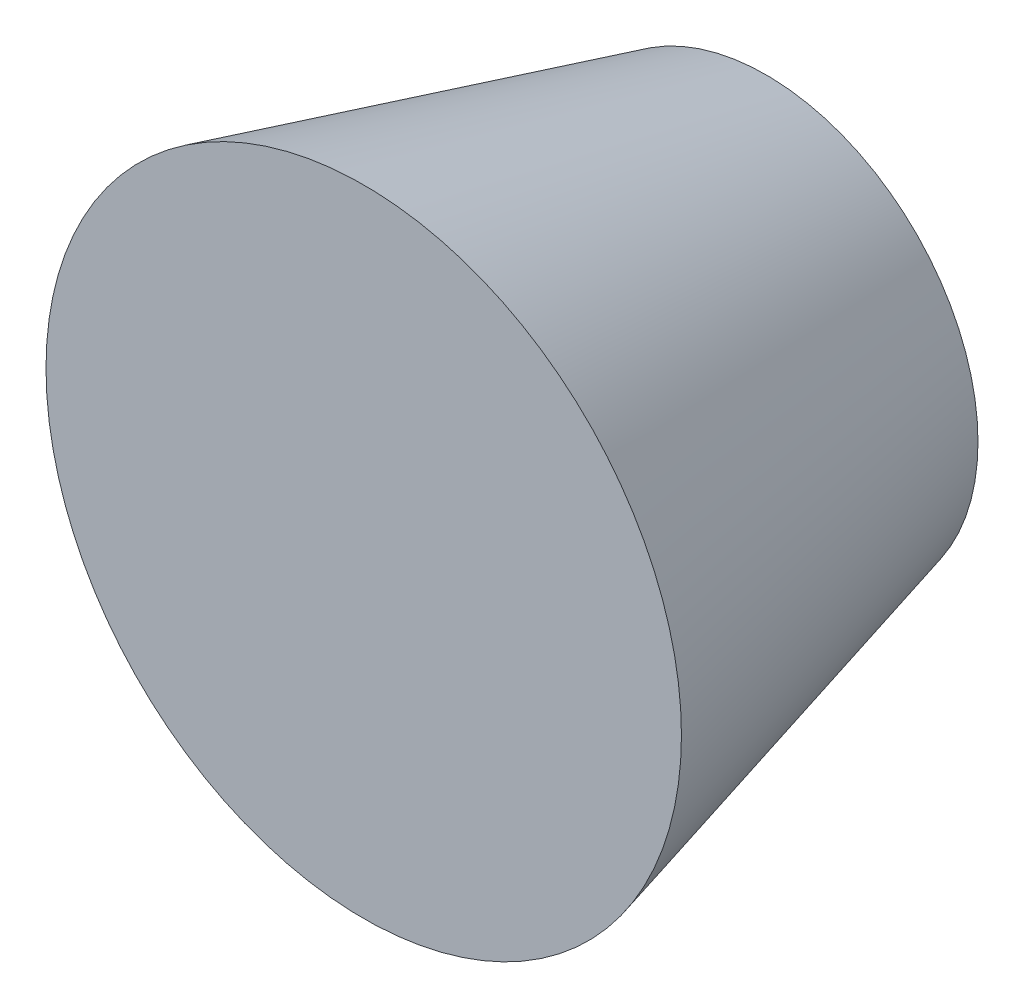
from build123d import *

# Parameters (mm, degrees)
SKETCH_1_R = 10
SKETCH_3_R = 15


with BuildPart() as part:
    # 草图1 → 放样1 section 0
    with BuildSketch(Plane.XY):
        Circle(SKETCH_1_R)
    # 草图3 → 放样1 section 1
    with BuildSketch(Plane.XY.offset(19)):
        Circle(SKETCH_3_R)
    loft()


solid = part.part
